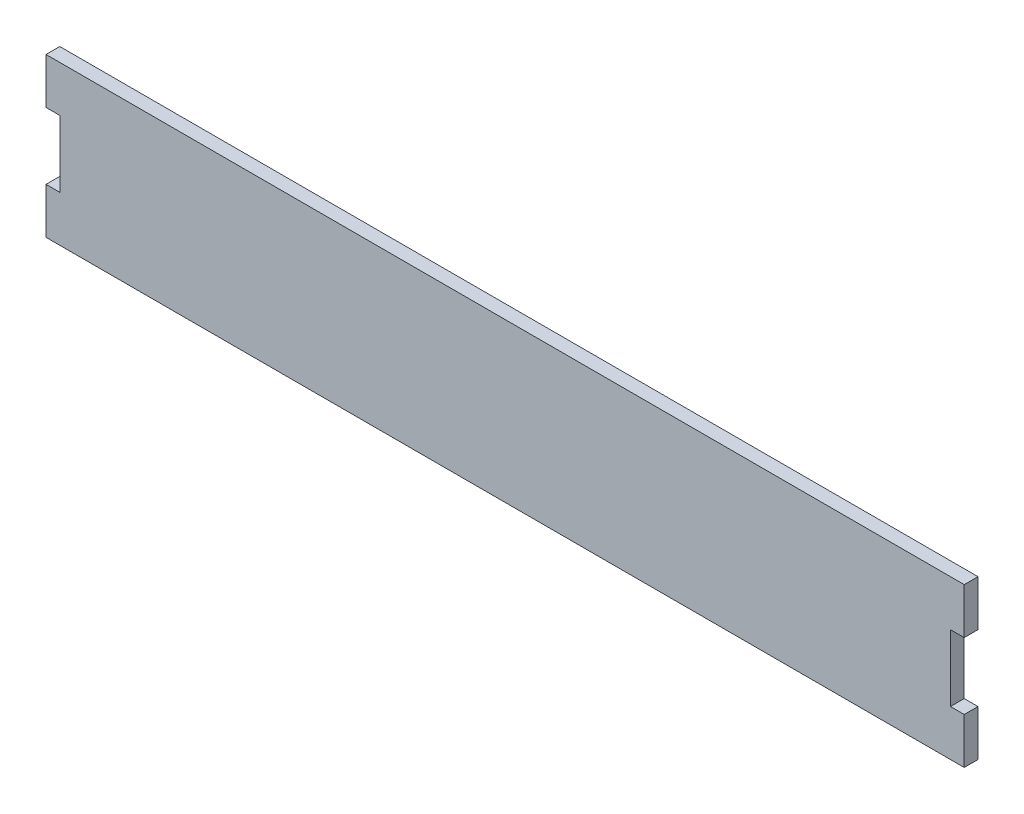
from build123d import *

# Parameters (mm, degrees)
EXTRUDE_1_DEPTH = 3


with BuildPart() as part:
    # ｽｹｯﾁ1 → ﾎﾞｽ - 押し出し1 (new body)
    with BuildSketch(Plane.XY):
        Polygon((0, 0), (0, 10), (3, 10), (3, 24.5), (0, 24.5), (0, 34.5), (200, 34.5), (200, 24.5), (197, 24.5), (197, 10), (200, 10), (200, 0), align=None)
    extrude(amount=EXTRUDE_1_DEPTH)


solid = part.part
